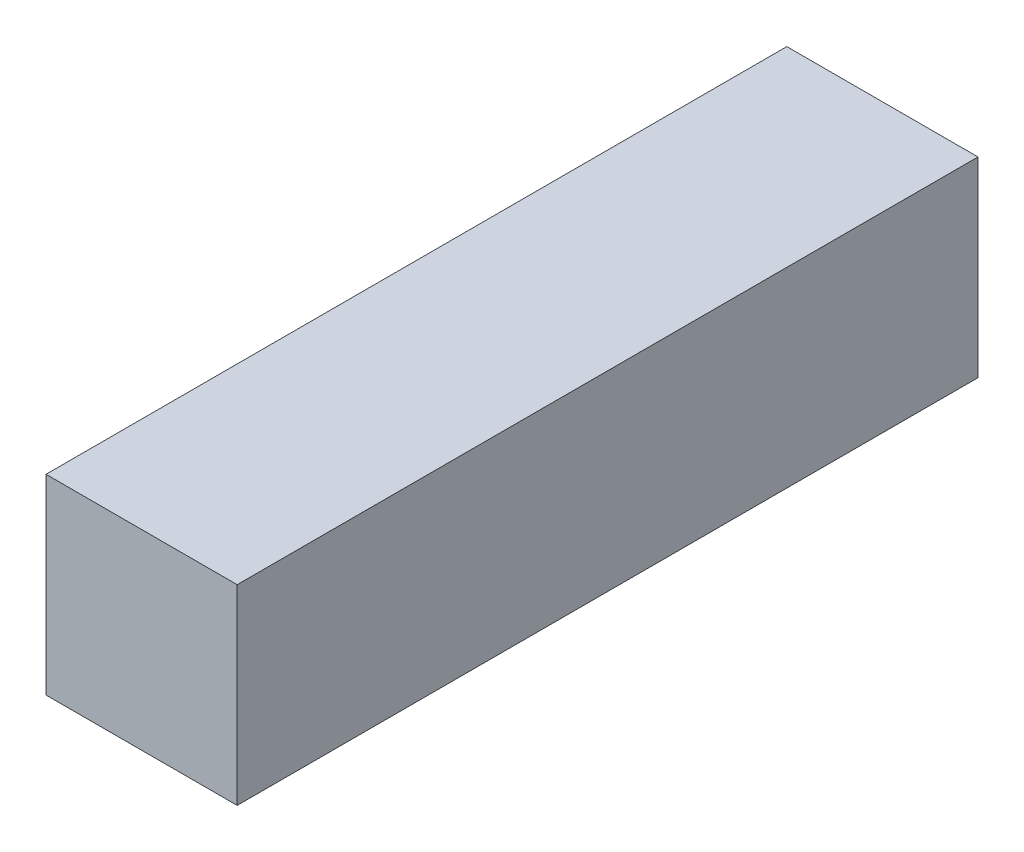
from build123d import *

# Parameters (mm, degrees)
BOSS_EXTRUDE1_DEPTH = 3
SKETCH2_W           = 4
SKETCH2_H           = 15.5
BOSS_EXTRUDE2_DEPTH = 1
CUT_EXTRUDE1_DEPTH  = 0.25


with BuildPart() as part:
    # Sketch1 → Boss-Extrude1 (new body)
    with BuildSketch(Plane(origin=(0, 0, 0), x_dir=(1, 0, 0), z_dir=(0, 1, 0))):
        Polygon((-1, -7.25), (1, -7.25), (1, 7.25), (2, 7.25), (2, -7.25), (2, -8.25), (1, -8.25), (-2, -8.25), (-2, 7.25), (-1, 7.25), align=None)
    extrude(amount=BOSS_EXTRUDE1_DEPTH)

    # Sketch2 → Boss-Extrude2 (add)
    with BuildSketch(Plane(origin=(0, 3, 0), x_dir=(1, 0, 0), z_dir=(0, 1, 0))):
        with Locations((0, -0.5)):
            Rectangle(SKETCH2_W, SKETCH2_H)
    extrude(amount=BOSS_EXTRUDE2_DEPTH)

    # Sketch3 → Cut-Extrude1 (cut)
    with BuildSketch(Plane.XZ):
        Polygon((-1, 7.25), (1, 7.25), (1, -7.25), (1.5, -7.25), (1.5, 7.717200742), (-1.5, 7.717200742), (-1.5, -7.25), (-1, -7.25), align=None)
    extrude(amount=-CUT_EXTRUDE1_DEPTH, mode=Mode.SUBTRACT)


solid = part.part
